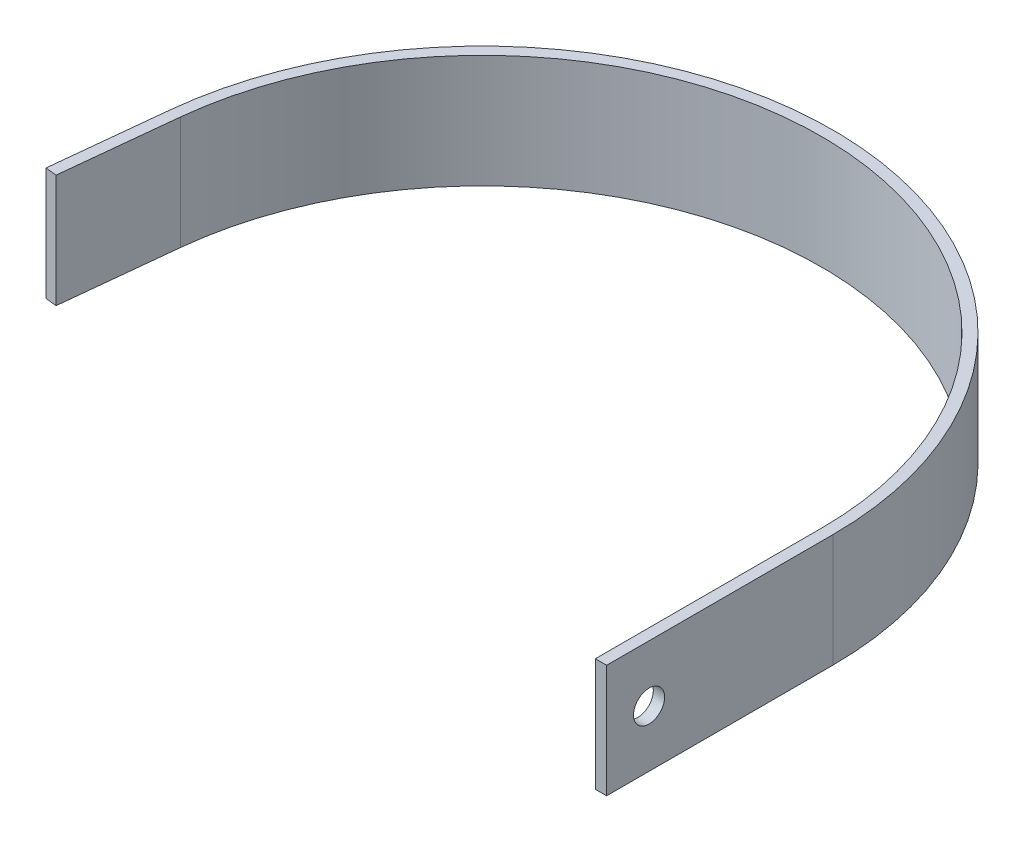
from build123d import *

# Parameters (mm, degrees)
RESSALTO_EXTRUS_O1_DEPTH = 20
ESBO_O2_R                = 2.75
CORTE_EXTRUS_O1_DEPTH    = 2


with BuildPart() as part:
    # Esboço1 → Ressalto-extrusão1 (new body)
    with BuildSketch(Plane(origin=(0, 0, 0), x_dir=(1, 0, 0), z_dir=(0, 1, 0))):
        with BuildLine():
            Line((-0.521579636, 13.959411341), (-2.612148901, -5.931026567))
            Line((-2.612148901, -5.931026567), (-4.601192692, -5.72196964))
            Line((-4.601192692, -5.72196964), (-2.510623427, 14.168468267))
            ThreePointArc((-2.510623427, 14.168468267), (62.394563373, 69.6027347), (121.149734086, 7.687703545))
            Line((121.149734086, 7.687703545), (121.149734086, -32.312296455))
            Line((121.149734086, -32.312296455), (119.149734086, -32.312296455))
            Line((119.149734086, -32.312296455), (119.149734086, 7.687703545))
            ThreePointArc((119.149734086, 7.687703545), (62.289891461, 67.60547563), (-0.521579636, 13.959411341))
        make_face()
    extrude(amount=RESSALTO_EXTRUS_O1_DEPTH)

    # Esboço2 → Corte-extrusão1 (cut)
    with BuildSketch(Plane(origin=(121.149734086, 0, 0), x_dir=(0, 0, -1), z_dir=(1, 0, 0))):
        with Locations((-24.812296455, 10)):
            Circle(ESBO_O2_R)
    extrude(amount=-CORTE_EXTRUS_O1_DEPTH, mode=Mode.SUBTRACT)


solid = part.part
